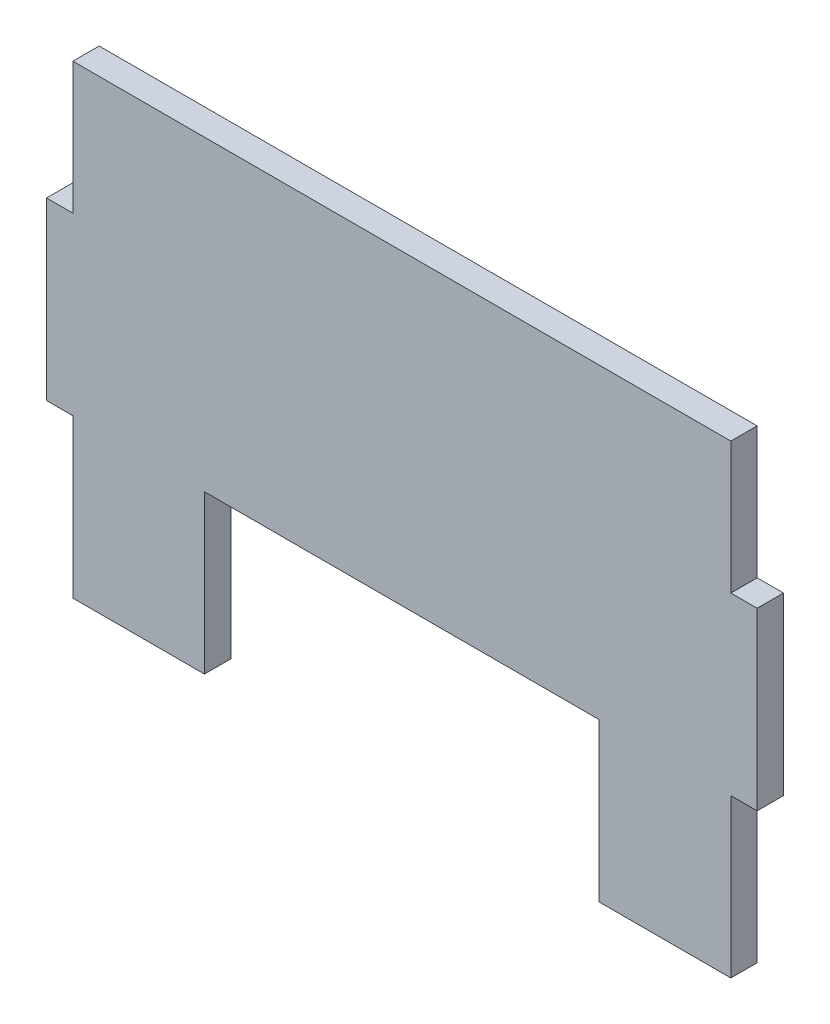
from build123d import *

# Parameters (mm, degrees)
ESBO_O1_W                = 150
ESBO_O1_H                = 100
RESSALTO_EXTRUS_O2_DEPTH = 6
ESBO_O3_W                = 90
ESBO_O3_H                = 30
CORTE_EXTRUS_O1_DEPTH    = 91.338253249
ESBO_O4_W                = 6
ESBO_O4_H                = 40
RESSALTO_EXTRUS_O4_DEPTH = 6
ESBO_O5_W                = 6
ESBO_O5_H                = 40
RESSALTO_EXTRUS_O5_DEPTH = 6
ESBO_O7_W                = 30
ESBO_O7_H                = 6
RESSALTO_EXTRUS_O7_DEPTH = 6
ESBO_O8_W                = 30
ESBO_O8_H                = 6
RESSALTO_EXTRUS_O8_DEPTH = 6


with BuildPart() as part:
    # Esboço1 → Ressalto-extrusão2 (new body)
    with BuildSketch(Plane.XY):
        Rectangle(ESBO_O1_W, ESBO_O1_H)
    extrude(amount=RESSALTO_EXTRUS_O2_DEPTH)

    # Esboço3 → Corte-extrusão1 (cut, through all)
    with BuildSketch(Plane.XY.offset(6)):
        with Locations((0, -35)):
            Rectangle(ESBO_O3_W, ESBO_O3_H)
    extrude(amount=-CORTE_EXTRUS_O1_DEPTH, mode=Mode.SUBTRACT)

    # Esboço4 → Ressalto-extrusão4 (add)
    with BuildSketch(Plane(origin=(75, 0, 0), x_dir=(0, 0, -1), z_dir=(1, 0, 0))):
        with Locations((-3, 0)):
            Rectangle(ESBO_O4_W, ESBO_O4_H)
    extrude(amount=RESSALTO_EXTRUS_O4_DEPTH)

    # Esboço5 → Ressalto-extrusão5 (add)
    with BuildSketch(Plane.ZY.offset(75)):
        with Locations((3, 0)):
            Rectangle(ESBO_O5_W, ESBO_O5_H)
    extrude(amount=RESSALTO_EXTRUS_O5_DEPTH)

    # Esboço7 → Ressalto-extrusão7 (add)
    with BuildSketch(Plane.XZ.offset(50)):
        with Locations((60, 3)):
            Rectangle(ESBO_O7_W, ESBO_O7_H)
    extrude(amount=RESSALTO_EXTRUS_O7_DEPTH)

    # Esboço8 → Ressalto-extrusão8 (add)
    with BuildSketch(Plane.XZ.offset(50)):
        with Locations((-60, 3)):
            Rectangle(ESBO_O8_W, ESBO_O8_H)
    extrude(amount=RESSALTO_EXTRUS_O8_DEPTH)


solid = part.part
